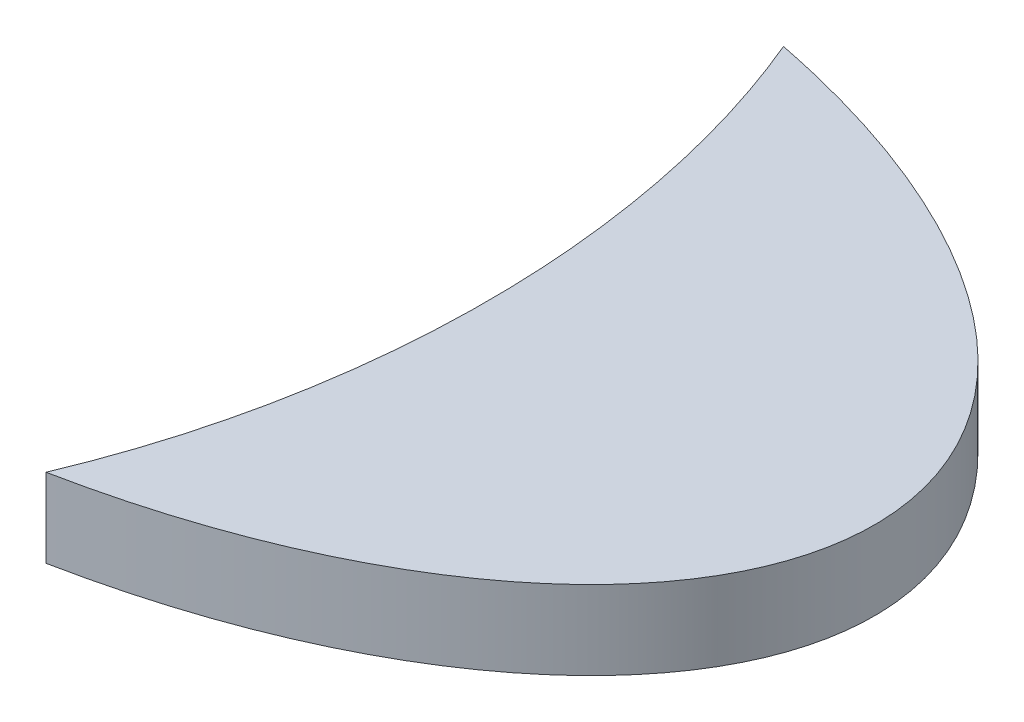
from build123d import *

# Parameters (mm, degrees)
BOSS_EXTRUDE1_DEPTH = 2


with BuildPart() as part:
    # Sketch3 → Boss-Extrude1 (new body)
    with BuildSketch(Plane(origin=(0, 0, 0), x_dir=(1, 0, 0), z_dir=(0, 1, 0))):
        with BuildLine():
            add(Edge.make_bspline(
                [(5.709947944, -9.349815334), (17.37, -7.03668365), (17.37, 0)],
                knots=[5.047341888, 5.047341888, 5.047341888, 6.283185307, 6.283185307, 6.283185307], degree=2, weights=[1, 0.815084258, 1]))
            add(Edge.make_bspline(
                [(17.37, 0), (17.37, 7.03668365), (5.709947944, 9.349815334)],
                knots=[0, 0, 0, 1.23584342, 1.23584342, 1.23584342], degree=2, weights=[1, 0.815084258, 1]))
            add(Edge.make_bspline(
                [(5.709947944, -9.349815334), (9.635045133, 0), (5.709947944, 9.349815334)],
                knots=[4.222743967, 4.222743967, 4.222743967, 5.202033994, 5.202033994, 5.202033994], degree=2, weights=[1, 0.882499869, 1]))
        make_face()
    extrude(amount=BOSS_EXTRUDE1_DEPTH)


solid = part.part
